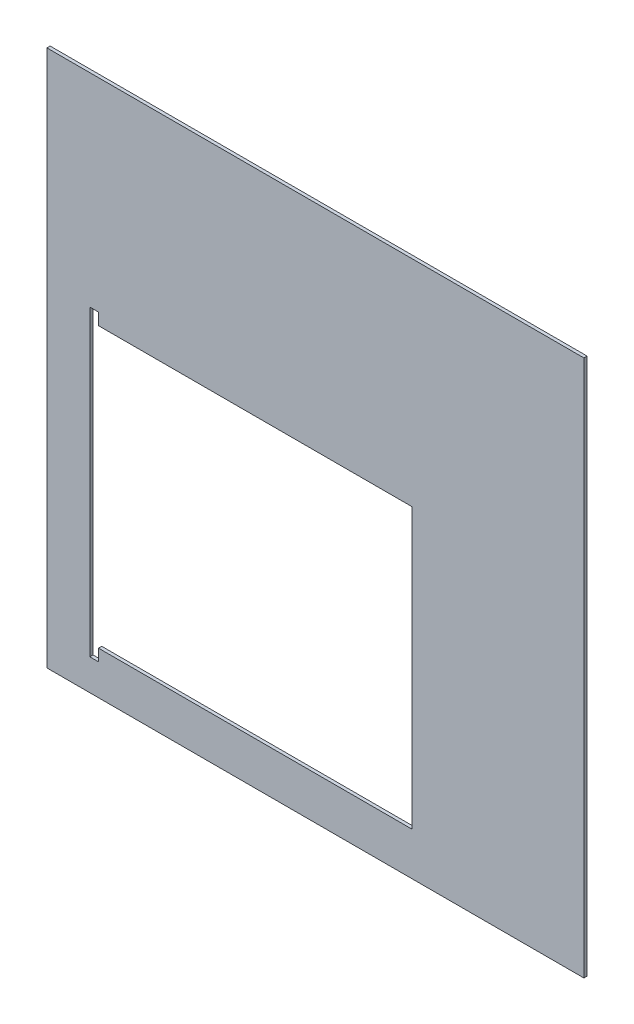
from build123d import *

# Parameters (mm, degrees)
ESQUISSE1_W        = 250
ESQUISSE1_H        = 250
BOSS_EXTRU_1_DEPTH = 1.5


with BuildPart() as part:
    # Esquisse1 → Boss.-Extru.1 (new body)
    with BuildSketch(Plane.XY):
        with Locations((125, 125)):
            Rectangle(ESQUISSE1_W, ESQUISSE1_H)
        Polygon((24, 20), (170, 20), (170, 150), (24, 150), (24, 155.5), (20, 155.5), (20, 150), (20, 20), (20, 14.5), (24, 14.5), align=None, mode=Mode.SUBTRACT)
    extrude(amount=BOSS_EXTRU_1_DEPTH)


solid = part.part
